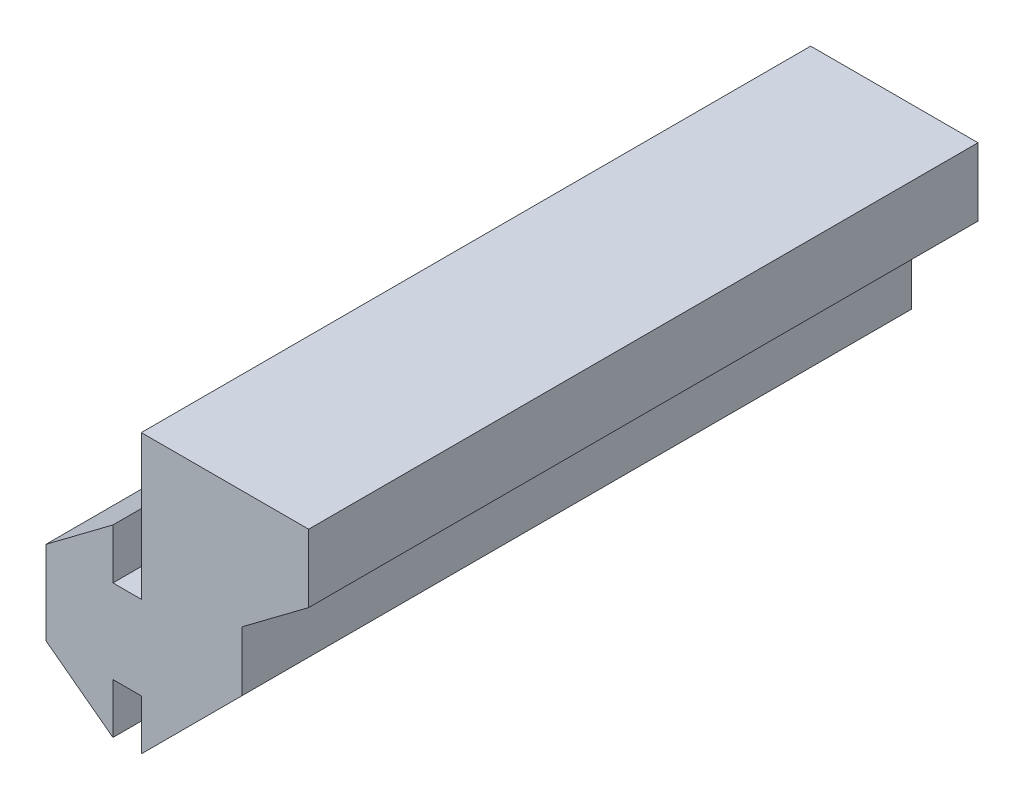
from build123d import *

# Parameters (mm, degrees)
MAIN_EXTRUSION_DEPTH = 40


with BuildPart() as part:
    # Main - Sketch → Main - Extrusion (new body)
    with BuildSketch(Plane.XY):
        Polygon((0, 0), (0, 5), (4, 8), (4, 5), (5.695841166, 5), (5.695841166, 13.628424951), (15.695841166, 13.628424951), (15.695841166, 9.571110416), (11.710231363, 6.581903064), (11.710231363, 3.014390197), (5.695841166, -3), (5.695841166, 0), (4, 0), (4, -3), align=None)
    extrude(amount=MAIN_EXTRUSION_DEPTH)


solid = part.part
